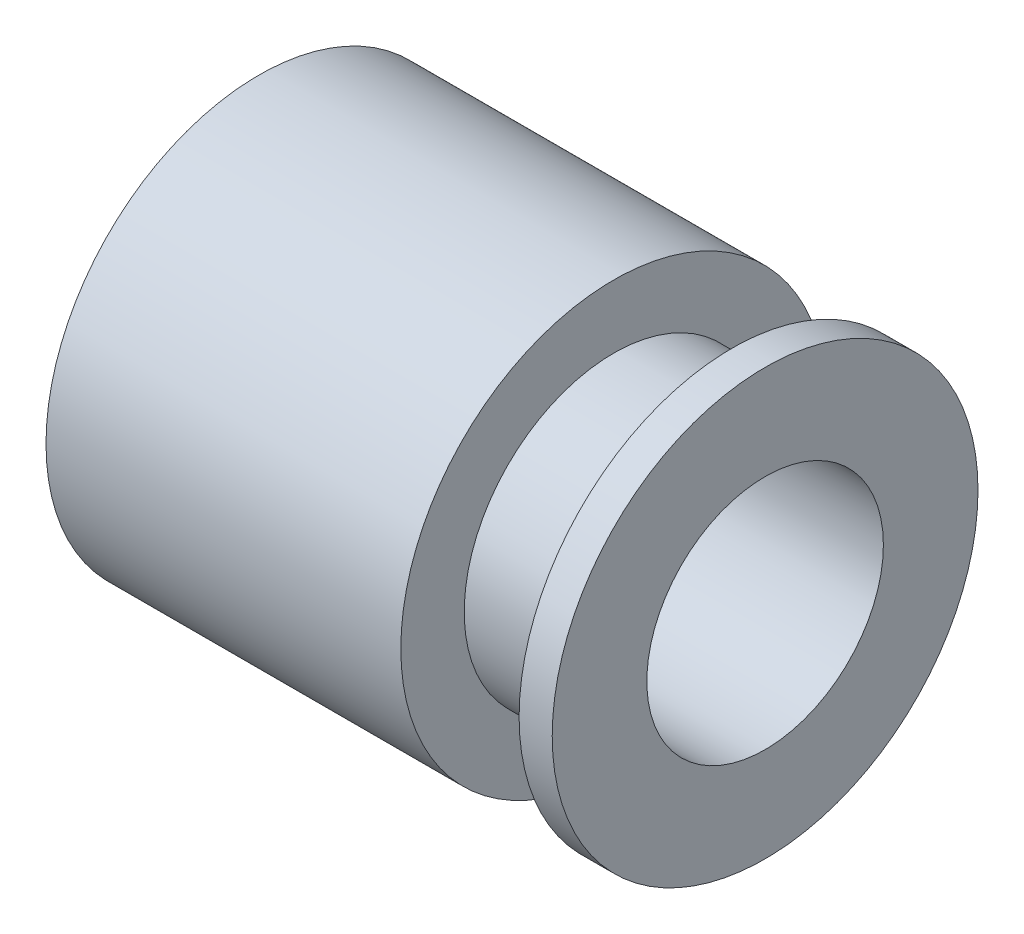
from build123d import *

# Parameters (mm, degrees)
SKETCH1_R           = 5.715
BOSS_EXTRUDE1_DEPTH = 9.525
SKETCH2_R           = 4.0132
BOSS_EXTRUDE2_DEPTH = 3.175
SKETCH3_R           = 5.715
BOSS_EXTRUDE3_DEPTH = 0.889
SKETCH4_R           = 3.175
CUT_EXTRUDE1_DEPTH  = 16.810862437
SKETCH5_R           = 4.0386
CUT_EXTRUDE2_DEPTH  = 8.255


with BuildPart() as part:
    # Sketch1 → Boss-Extrude1 (new body)
    with BuildSketch(Plane(origin=(0, 0, 0), x_dir=(0, 0, -1), z_dir=(1, 0, 0))):
        with Locations(Location((0, 0, 0), (0, 0, 180))):
            Circle(SKETCH1_R)
    extrude(amount=BOSS_EXTRUDE1_DEPTH)

    # Sketch2 → Boss-Extrude2 (add)
    with BuildSketch(Plane(origin=(9.525, 0, 0), x_dir=(0, 0, -1), z_dir=(1, 0, 0))):
        Circle(SKETCH2_R)
    extrude(amount=BOSS_EXTRUDE2_DEPTH)

    # Sketch3 → Boss-Extrude3 (add)
    with BuildSketch(Plane(origin=(12.7, 0, 0), x_dir=(0, 0, -1), z_dir=(1, 0, 0))):
        with Locations(Location((0, 0, 0), (0, 0, 180))):
            Circle(SKETCH3_R)
    extrude(amount=BOSS_EXTRUDE3_DEPTH)

    # Sketch4 → Cut-Extrude1 (cut, through all)
    with BuildSketch(Plane(origin=(13.589, 0, 0), x_dir=(0, 0, -1), z_dir=(1, 0, 0))):
        Circle(SKETCH4_R)
    extrude(amount=-CUT_EXTRUDE1_DEPTH, mode=Mode.SUBTRACT)

    # Sketch5 → Cut-Extrude2 (cut)
    with BuildSketch(Plane.ZY):
        Circle(SKETCH5_R)
    extrude(amount=-CUT_EXTRUDE2_DEPTH, mode=Mode.SUBTRACT)


solid = part.part
